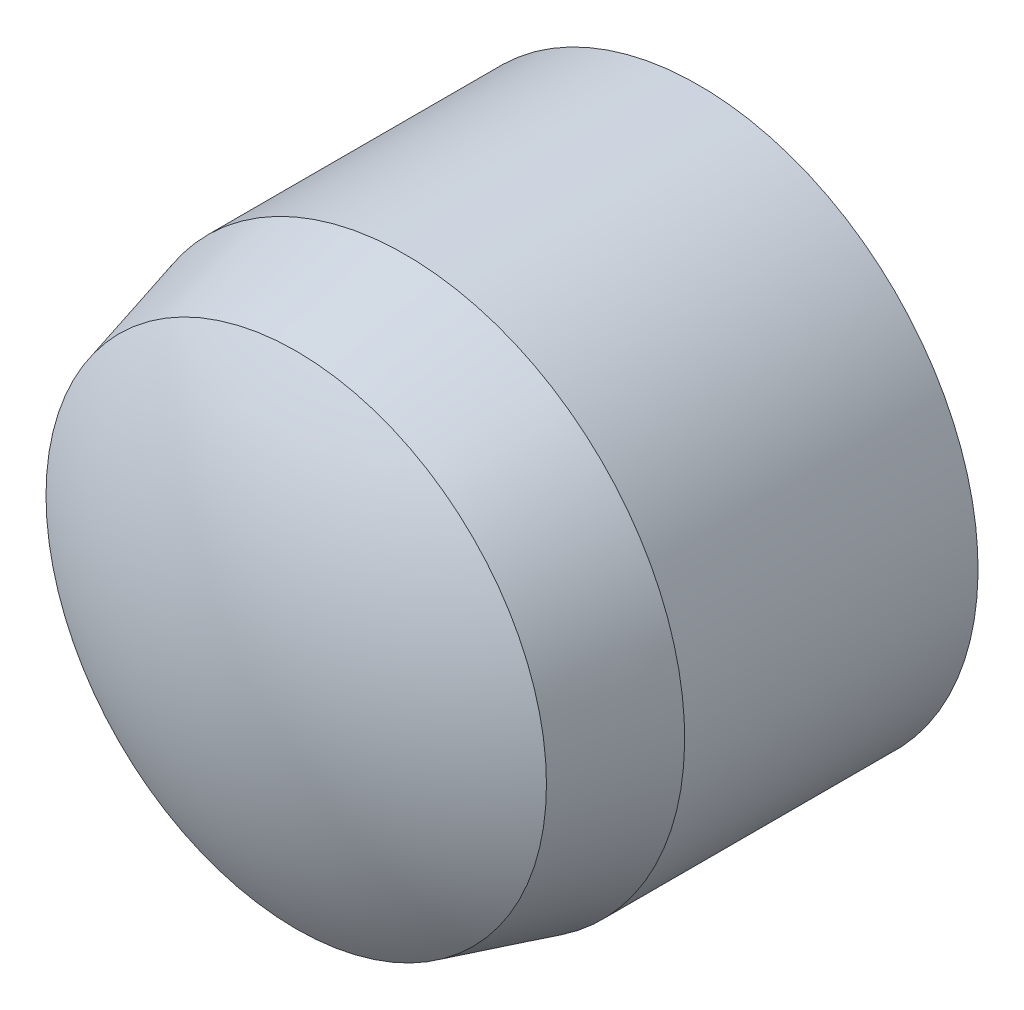
from build123d import *


with BuildPart() as part:
    # Sketch3 → Revolve1 (revolve)
    with BuildSketch(Plane(origin=(0, 0, 0), x_dir=(0, 0, -1), z_dir=(1, 0, 0)), mode=Mode.PRIVATE) as revolve1_sk:
        with BuildLine():
            Line((-2.5, 0), (2.5, 0))
            ThreePointArc((2.5, 0), (2.308461045, 1.305038314), (1.75, 2.5))
            Line((1.75, 2.5), (-0.875, 2.5))
            Line((-0.875, 2.5), (-1.85, 2.238749537))
            ThreePointArc((-1.85, 2.238749537), (-2.334212566, 1.165600649), (-2.5, 0))
        make_face()
    revolve(revolve1_sk.sketch.rotate(Axis((0, 0, 2.5), (0, 0, -1)), 180), axis=Axis((0, 0, 2.5), (0, 0, -1)))


solid = part.part
